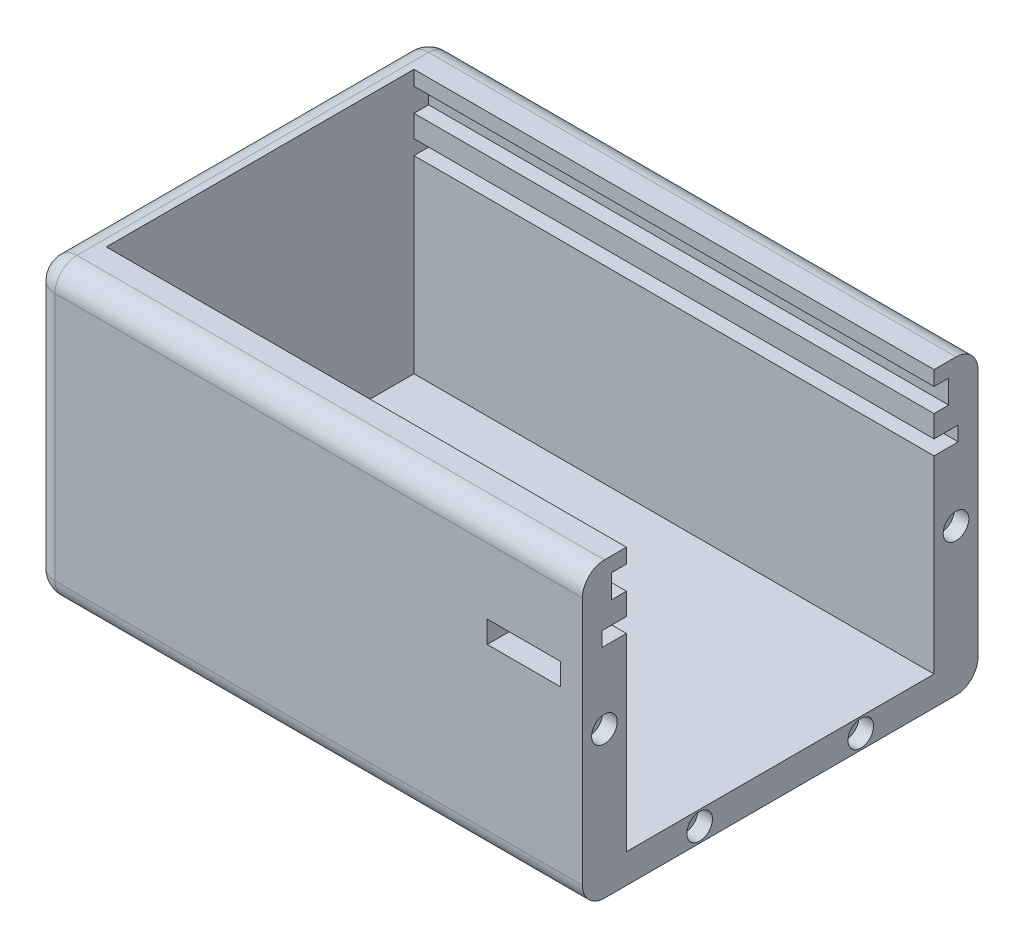
from build123d import *

# Parameters (mm, degrees)
ESQUISSE1_W             = 75
ESQUISSE1_H             = 54
BOSS_EXTRU_1_DEPTH      = 40
ESQUISSE2_W             = 42
ESQUISSE2_H             = 36.230264554
ENL_V_MAT_EXTRU_1_DEPTH = 71
ESQUISSE4_W             = 2
ESQUISSE4_H             = 3.2
ESQUISSE4_W_2           = 3.3
ESQUISSE4_H_2           = 2
ENL_V_MAT_EXTRU_2_DEPTH = 72
ESQUISSE8_W             = 10
ESQUISSE8_H             = 3
ENL_V_MAT_EXTRU_5_DEPTH = 11
ESQUISSE9_R             = 1.75
ENL_V_MAT_EXTRU_6_DEPTH = 2
CONG_1_R                = 3


with BuildPart() as part:
    # Esquisse1 → Boss.-Extru.1 (new body)
    with BuildSketch(Plane(origin=(0, 0, 0), x_dir=(1, 0, 0), z_dir=(0, 1, 0))):
        Rectangle(ESQUISSE1_W, ESQUISSE1_H)
    extrude(amount=BOSS_EXTRU_1_DEPTH)

    # Esquisse2 → Enlèv. mat.-Extru.1 (cut)
    with BuildSketch(Plane(origin=(37.5, 0, 0), x_dir=(0, 0, -1), z_dir=(1, 0, 0))):
        with Locations((0, 22.115132277)):
            Rectangle(ESQUISSE2_W, ESQUISSE2_H)
    extrude(amount=-ENL_V_MAT_EXTRU_1_DEPTH, mode=Mode.SUBTRACT)

    # Esquisse4 → Enlèv. mat.-Extru.2 (cut)
    with BuildSketch(Plane(origin=(-33.5, 0, 0), x_dir=(0, 0, -1), z_dir=(1, 0, 0))):
        with Locations((-22, 36.4)):
            Rectangle(ESQUISSE4_W, ESQUISSE4_H)
        with Locations((-22.65, 30.8)):
            Rectangle(ESQUISSE4_W_2, ESQUISSE4_H_2)
        with Locations((22, 36.4)):
            Rectangle(ESQUISSE4_W, ESQUISSE4_H)
        with Locations((22.65, 30.8)):
            Rectangle(ESQUISSE4_W_2, ESQUISSE4_H_2)
    extrude(amount=ENL_V_MAT_EXTRU_2_DEPTH, mode=Mode.SUBTRACT)

    # Esquisse8 → Enlèv. mat.-Extru.5 (cut)
    with BuildSketch(Plane.XY.offset(27)):
        with Locations((29.5, 26.5)):
            Rectangle(ESQUISSE8_W, ESQUISSE8_H)
    extrude(amount=-ENL_V_MAT_EXTRU_5_DEPTH, mode=Mode.SUBTRACT)

    # Esquisse9 → Enlèv. mat.-Extru.6 (cut)
    with BuildSketch(Plane(origin=(37.5, 0, 0), x_dir=(0, 0, -1), z_dir=(1, 0, 0))):
        with Locations((-24, 20)):
            Circle(ESQUISSE9_R)
        with Locations((-11, 2)):
            Circle(ESQUISSE9_R)
        with Locations((11, 2)):
            Circle(ESQUISSE9_R)
        with Locations((24, 20)):
            Circle(ESQUISSE9_R)
    extrude(amount=-ENL_V_MAT_EXTRU_6_DEPTH, mode=Mode.SUBTRACT)

    # Congé1
    cong_1_edges = [part.edges().sort_by_distance(p)[0] for p in [
        (-37.5, 40, 0),
        (0, 40, 27),
        (0, 0, 27),
        (-37.5, 0, 0),
        (0, 0, -27),
        (-37.5, 20, 27),
        (-37.5, 20, -27),
        (0, 40, -27),
    ]]
    fillet(cong_1_edges, radius=CONG_1_R)


solid = part.part
